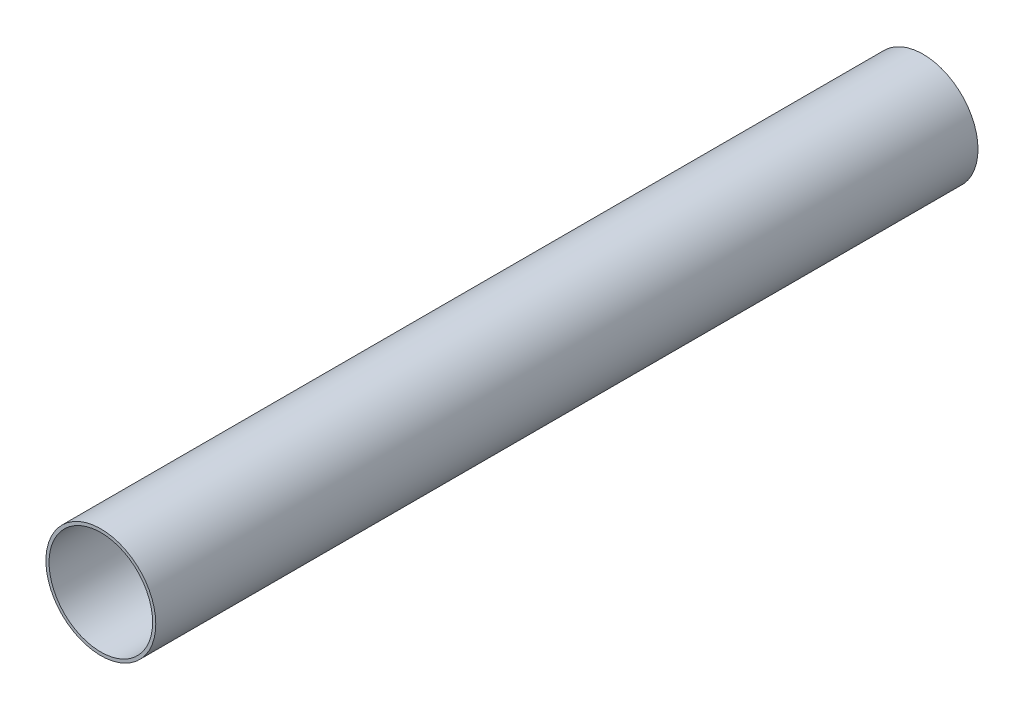
from build123d import *

# Parameters (mm, degrees)
SKETCH2_R           = 44.1325
SKETCH2_R_2         = 41.5925
BOSS_EXTRUDE1_DEPTH = 660.4


with BuildPart() as part:
    # Sketch2 → Boss-Extrude1 (new body)
    with BuildSketch(Plane.XY):
        Circle(SKETCH2_R)
        Circle(SKETCH2_R_2, mode=Mode.SUBTRACT)
    extrude(amount=BOSS_EXTRUDE1_DEPTH)


solid = part.part
